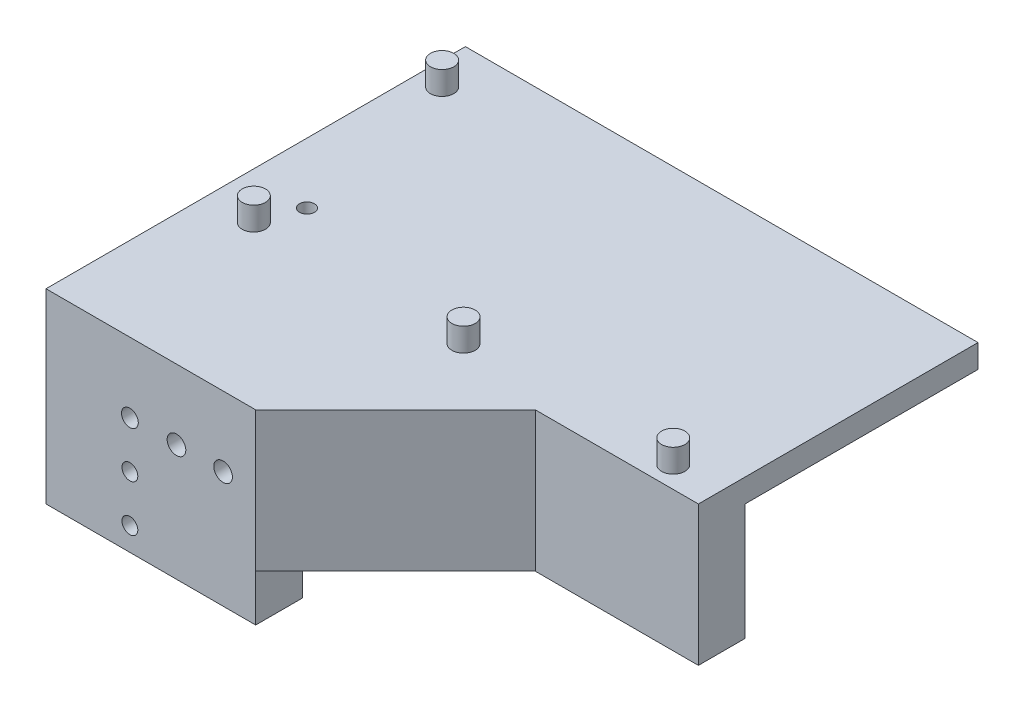
from build123d import *

# Parameters (mm, degrees)
SKETCH1_W               = 139.7
SKETCH1_H               = 76.2
BOSS_EXTRUDE1_DEPTH     = 38.1
CUT_EXTRUDE1_DEPTH      = 89.217019333
CUT_EXTRUDE1_DEPTH_BACK = 31.75
SKETCH3_R               = 2.032
CUT_EXTRUDE2_DEPTH      = 89.217019333
SKETCH4_W               = 52.07
SKETCH4_H               = 25.4
CUT_EXTRUDE3_DEPTH      = 10.414
SKETCH7_W               = 57.15
SKETCH7_H               = 12.7
BOSS_EXTRUDE2_DEPTH     = 25.4
SKETCH8_W               = 57.15
SKETCH8_H               = 50.8
BOSS_EXTRUDE3_DEPTH     = 12.7
SKETCH5_R               = 2.286
SKETCH5_R_2             = 2.54
CUT_EXTRUDE4_DEPTH      = 109.570070904
CUT_EXTRUDE5_DEPTH      = 14.986
CUT_EXTRUDE6_DEPTH      = 7.112
SKETCH10_R              = 2.159
CUT_EXTRUDE7_DEPTH      = 139.84509874
SKETCH11_W              = 52.07
SKETCH11_H              = 6.35
BOSS_EXTRUDE4_DEPTH     = 25.4
BOSS_EXTRUDE5_DEPTH     = 38.1
SKETCH15_R              = 3.175
CUT_EXTRUDE8_DEPTH      = 6.35
SKETCH16_R              = 3.175
BOSS_EXTRUDE6_DEPTH     = 6.35


with BuildPart() as part:
    # Sketch1 → Boss-Extrude1 (new body)
    with BuildSketch(Plane(origin=(0, 0, 0), x_dir=(1, 0, 0), z_dir=(0, 1, 0))):
        Rectangle(SKETCH1_W, SKETCH1_H)
    extrude(amount=-BOSS_EXTRUDE1_DEPTH)

    # Sketch2 → Cut-Extrude1 (cut, two sides: drawn at the far end of the back side and taken through both)
    with BuildSketch(Plane.XZ.offset(38.1).offset(-CUT_EXTRUDE1_DEPTH_BACK)):
        Polygon((386.759367729, 25.4), (69.85, 25.4), (7.62, 25.4), (7.62, 0), (-58.42, 0), (-58.42, -38.1), (-58.42, -355.009367729), (353.331408797, -836.86719611), (798.510776526, -456.457828381), align=None)
    extrude(amount=CUT_EXTRUDE1_DEPTH + CUT_EXTRUDE1_DEPTH_BACK, mode=Mode.SUBTRACT)

    # Sketch3 → Cut-Extrude2 (cut, through all)
    with BuildSketch(Plane.XZ.offset(38.1)):
        with Locations(Location((-53.34, 21.59, 0), (0, 0, 270))):
            Circle(SKETCH3_R)
    extrude(amount=-CUT_EXTRUDE2_DEPTH, mode=Mode.SUBTRACT)

    # Sketch4 → Cut-Extrude3 (cut)
    with BuildSketch(Plane(origin=(0, 0, 0), x_dir=(-1, 0, 0), z_dir=(0, 0, -1))):
        with Locations((32.385, -19.05)):
            Rectangle(SKETCH4_W, SKETCH4_H)
    extrude(amount=-CUT_EXTRUDE3_DEPTH, mode=Mode.SUBTRACT)

    # Sketch7 → Boss-Extrude2 (add)
    with BuildSketch(Plane.XY.offset(38.1)):
        with Locations((-41.275, -6.35)):
            Rectangle(SKETCH7_W, SKETCH7_H)
    extrude(amount=BOSS_EXTRUDE2_DEPTH)

    # Sketch8 → Boss-Extrude3 (add)
    with BuildSketch(Plane.XY.offset(63.5)):
        with Locations((-41.275, -25.4)):
            Rectangle(SKETCH8_W, SKETCH8_H)
    extrude(amount=BOSS_EXTRUDE3_DEPTH)

    # Sketch5 → Cut-Extrude4 (cut, through all)
    with BuildSketch(Plane(origin=(0, 0, 10.414), x_dir=(-1, 0, 0), z_dir=(0, 0, -1))):
        with Locations((46.99, -19.05)):
            Circle(SKETCH5_R)
        with Locations((34.29, -19.05)):
            Circle(SKETCH5_R_2)
        with Locations((21.59, -19.05)):
            Circle(SKETCH5_R_2)
    extrude(amount=-CUT_EXTRUDE4_DEPTH, mode=Mode.SUBTRACT)

    # Sketch6 → Cut-Extrude5 (cut)
    with BuildSketch(Plane(origin=(0, 0, 10.414), x_dir=(-1, 0, 0), z_dir=(0, 0, -1))):
        with BuildLine():
            Line((27.051, -18.288), (26.612524863, -18.288))
            ThreePointArc((26.612524863, -18.288), (16.51, -19.05), (26.612524863, -19.812))
            Line((26.612524863, -19.812), (27.051, -19.812))
            Line((27.051, -19.812), (27.051, -21.082))
            Line((27.051, -21.082), (28.829, -21.082))
            Line((28.829, -21.082), (28.829, -19.812))
            Line((28.829, -19.812), (29.267475137, -19.812))
            ThreePointArc((29.267475137, -19.812), (39.37, -19.05), (29.267475137, -18.288))
            Line((29.267475137, -18.288), (28.829, -18.288))
            Line((28.829, -18.288), (28.829, -17.018))
            Line((28.829, -17.018), (27.051, -17.018))
            Line((27.051, -17.018), (27.051, -18.288))
        make_face()
    extrude(amount=-CUT_EXTRUDE5_DEPTH, mode=Mode.SUBTRACT)

    # Sketch9 → Cut-Extrude6 (cut)
    with BuildSketch(Plane(origin=(0, 0, 63.5), x_dir=(-1, 0, 0), z_dir=(0, 0, -1))):
        Polygon((42.323188216, -16.865376771), (42.323188216, -46.634623229), (44.704, -49.276), (49.276, -49.276), (51.656811784, -46.634623229), (51.656811784, -16.865376771), (49.276, -14.224), (44.704, -14.224), align=None)
    extrude(amount=-CUT_EXTRUDE6_DEPTH, mode=Mode.SUBTRACT)

    # Sketch10 → Cut-Extrude7 (cut, through all)
    with BuildSketch(Plane(origin=(0, 0, 70.612), x_dir=(-1, 0, 0), z_dir=(0, 0, -1))):
        with Locations((46.99, -19.05)):
            Circle(SKETCH10_R)
        with Locations((46.99, -31.75)):
            Circle(SKETCH10_R)
        with Locations((46.99, -44.45)):
            Circle(SKETCH10_R)
    extrude(amount=-CUT_EXTRUDE7_DEPTH, mode=Mode.SUBTRACT)

    # Sketch11 → Boss-Extrude4 (add)
    with BuildSketch(Plane(origin=(0, 0, 0), x_dir=(-1, 0, 0), z_dir=(0, 0, -1))):
        with Locations((32.385, -34.925)):
            Rectangle(SKETCH11_W, SKETCH11_H)
    extrude(amount=BOSS_EXTRUDE4_DEPTH)

    # Sketch14 → Boss-Extrude5 (add)
    with BuildSketch(Plane(origin=(0, 0, 0), x_dir=(1, 0, 0), z_dir=(0, 1, 0))):
        Polygon((-12.7, -76.2), (25.4, -38.1), (-12.7, -38.1), align=None)
    extrude(amount=-BOSS_EXTRUDE5_DEPTH)

    # Sketch15 → Cut-Extrude8 (cut)
    with BuildSketch(Plane.XZ.offset(38.1)):
        with Locations(Location((57.15, 31.75, 0), (0, 0, 270))):
            Circle(SKETCH15_R)
        with Locations(Location((0.000881951, 32.0675, 0), (0, 0, 270))):
            Circle(SKETCH15_R)
        with Locations(Location((-57.148236098, 32.385, 0), (0, 0, 270))):
            Circle(SKETCH15_R)
    extrude(amount=-CUT_EXTRUDE8_DEPTH, mode=Mode.SUBTRACT)

    # Sketch16 → Boss-Extrude6 (add)
    with BuildSketch(Plane(origin=(0, 0, 0), x_dir=(1, 0, 0), z_dir=(0, 1, 0))):
        with Locations(Location((57.15, -32.258, 0), (0, 0, 90))):
            Circle(SKETCH16_R)
        with Locations(Location((0, -32.258, 0), (0, 0, 90))):
            Circle(SKETCH16_R)
        with Locations(Location((-57.15, -32.258, 0), (0, 0, 90))):
            Circle(SKETCH16_R)
        with Locations(Location((-63.5, 25.4, 0), (0, 0, 90))):
            Circle(SKETCH16_R)
    extrude(amount=BOSS_EXTRUDE6_DEPTH)


solid = part.part
